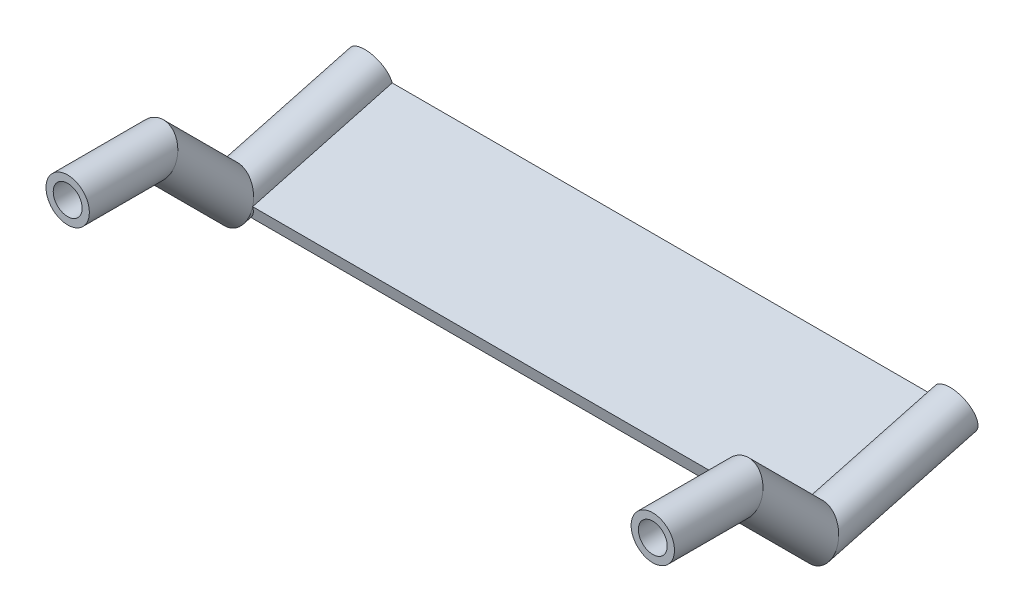
from build123d import *

# Parameters (mm, degrees)
SWEEP_THIN1_PROFILE_R   = 30
SWEEP_THIN1_PROFILE_R_2 = 20
EXTRUDE_THIN1_START     = 20
EXTRUDE_THIN1_DEPTH     = 760


with BuildPart() as part:
    # Sweep-Thin1: sweep along a path in Sketch2
    with BuildLine(Plane(origin=(0, 0, 0), x_dir=(0, 0, -1), z_dir=(1, 0, 0))) as sweep_thin1_path:
        Line((0, 0), (120, 0))
        Line((120, 0), (226.066017178, -106.066017178))
        Line((226.066017178, -106.066017178), (419.251182436, -54.302208157))
    # Sweep-Thin1 profile (on start of the path) → Sweep-Thin1 (sweep)
    with BuildSketch(Plane(origin=(0, 0, 0), x_dir=(-1, 0, 0), z_dir=(0, 0, -1))):
        Circle(SWEEP_THIN1_PROFILE_R)
        Circle(SWEEP_THIN1_PROFILE_R_2, mode=Mode.SUBTRACT)
    sweep(path=sweep_thin1_path.line, transition=Transition.RIGHT)

    # Sketch13 → Extrude-Thin1 (add)
    with BuildSketch(Plane(origin=(0, 0, 0), x_dir=(0, 0, -1), z_dir=(1, 0, 0)).offset(EXTRUDE_THIN1_START)):
        Polygon((226.066017178, -106.066017178), (419.251182436, -54.302208157), (424.427563338, -73.620724683), (231.24239808, -125.384533704), align=None)
    extrude(amount=EXTRUDE_THIN1_DEPTH)

    # Mirror4: part across plane


with BuildPart() as part_1:
    add(part.part)
    add(part.part.mirror(Plane(origin=(405, 0, 0), x_dir=(0, 0, 1), z_dir=(1, 0, 0))))


solid = part_1.part
